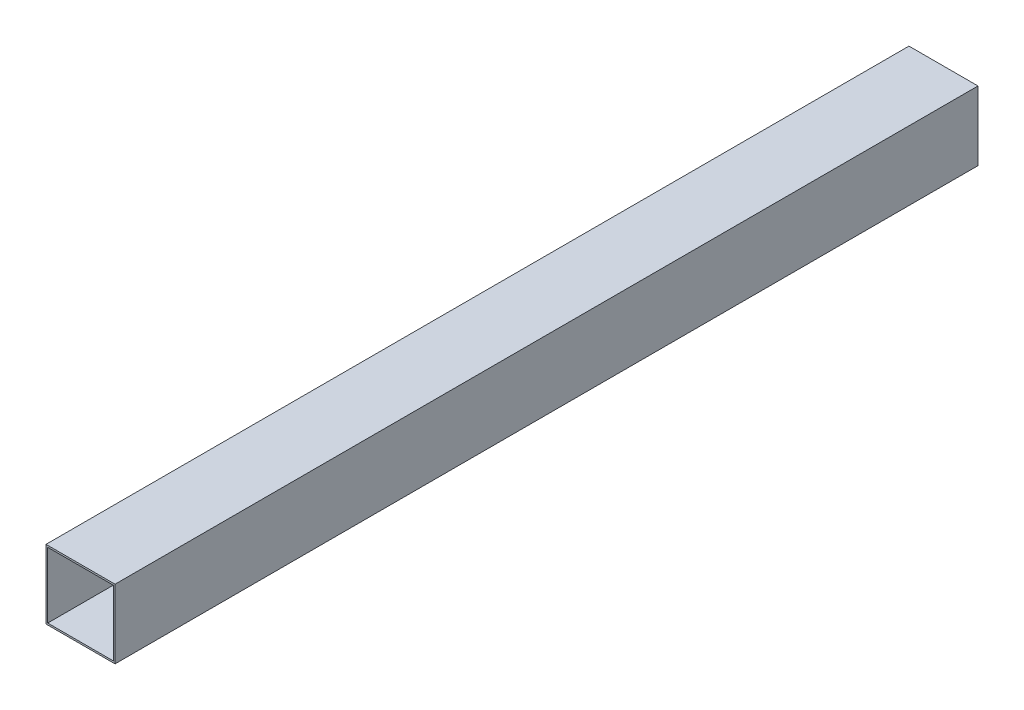
from build123d import *

# Parameters (mm, degrees)
SZKIC1_W                    = 40
SZKIC1_H                    = 40
SZKIC1_W_2                  = 38
SZKIC1_H_2                  = 38
DODANIE_WYCI_GNI_CIE1_DEPTH = 500


with BuildPart() as part:
    # Szkic1 → Dodanie-wyciągnięcie1 (new body)
    with BuildSketch(Plane.XY):
        with Locations((20, 9.522889604)):
            Rectangle(SZKIC1_W, SZKIC1_H)
        with Locations((20, 9.522889604)):
            Rectangle(SZKIC1_W_2, SZKIC1_H_2, mode=Mode.SUBTRACT)
    extrude(amount=DODANIE_WYCI_GNI_CIE1_DEPTH)


solid = part.part
